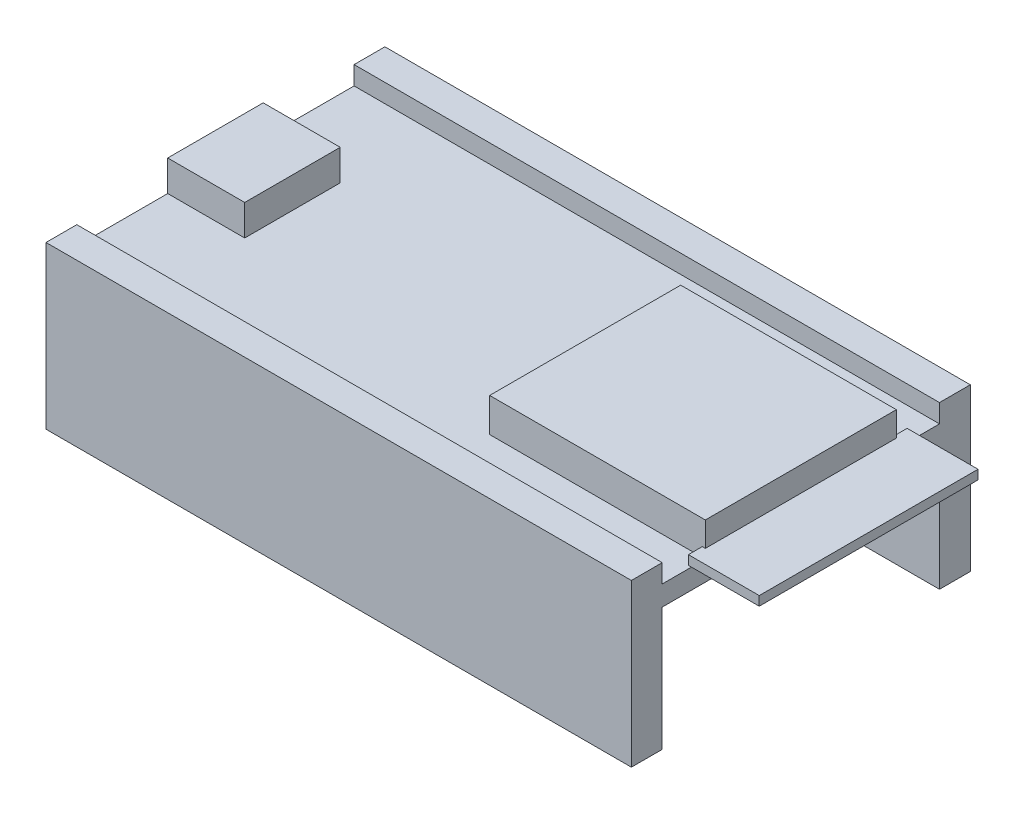
from build123d import *

# Parameters (mm, degrees)
SKETCH1_W                = 48.26
SKETCH1_H                = 27.94
BOSS_EXTRUDE1_DEPTH      = 1.651
BOSS_EXTRUDE2_START      = -11.811
SKETCH2_W                = 48.26
SKETCH2_H                = 2.54
BOSS_EXTRUDE2_DEPTH      = 13.335
SKETCH3_W                = 17.78
SKETCH3_H                = 15.748
BOSS_EXTRUDE3_DEPTH      = 2.794
BOSS_EXTRUDE6_DEPTH      = 5.588
BOSS_EXTRUDE6_DEPTH_BACK = 0.254
SKETCH4_W                = 18.034
SKETCH4_H                = 0.762
SKETCH5_W                = 6.35
SKETCH5_H                = 7.874
BOSS_EXTRUDE7_DEPTH      = 2.54


with BuildPart() as part:
    # Sketch1 → Boss-Extrude1 (new body)
    with BuildSketch(Plane(origin=(0, 0, 0), x_dir=(1, 0, 0), z_dir=(0, 1, 0))):
        Rectangle(SKETCH1_W, SKETCH1_H)
    extrude(amount=BOSS_EXTRUDE1_DEPTH)

    # Sketch2 → Boss-Extrude2 (add)
    with BuildSketch(Plane(origin=(0, 1.651, 0), x_dir=(1, 0, 0), z_dir=(0, 1, 0)).offset(BOSS_EXTRUDE2_START)):
        with Locations((0, -12.7)):
            Rectangle(SKETCH2_W, SKETCH2_H)
    boss_extrude2 = extrude(amount=BOSS_EXTRUDE2_DEPTH)

    # Mirror1: Boss-Extrude2 across plane
    add(boss_extrude2.mirror(Plane.XY))

    # Sketch3 → Boss-Extrude3 (add)
    with BuildSketch(Plane(origin=(0, 1.651, 0), x_dir=(1, 0, 0), z_dir=(0, 1, 0))):
        with Locations((15.24, 0)):
            Rectangle(SKETCH3_W, SKETCH3_H)
    extrude(amount=BOSS_EXTRUDE3_DEPTH)

    # Sketch4 → Boss-Extrude6 (add, two sides: drawn at the far end of the back side and taken through both)
    with BuildSketch(Plane(origin=(24.13, 0, 0), x_dir=(0, 0, -1), z_dir=(1, 0, 0)).offset(-BOSS_EXTRUDE6_DEPTH_BACK)):
        with Locations((0, 2.032)):
            Rectangle(SKETCH4_W, SKETCH4_H)
    extrude(amount=BOSS_EXTRUDE6_DEPTH + BOSS_EXTRUDE6_DEPTH_BACK)

    # Sketch5 → Boss-Extrude7 (add)
    with BuildSketch(Plane(origin=(0, 1.651, 0), x_dir=(1, 0, 0), z_dir=(0, 1, 0))):
        with Locations((-20.955, 0)):
            Rectangle(SKETCH5_W, SKETCH5_H)
    extrude(amount=BOSS_EXTRUDE7_DEPTH)


solid = part.part
